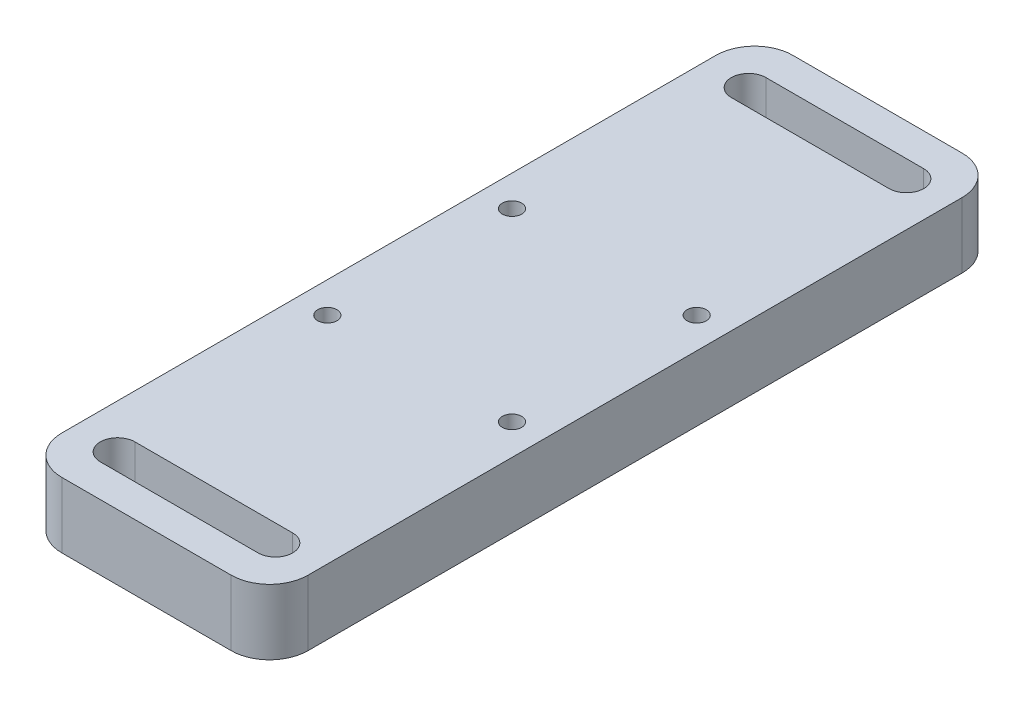
from build123d import *

# Parameters (mm, degrees)
SKETCH_1_W                = 32
SKETCH_1_H                = 35
EXTRUDE_1_DEPTH           = 10.75
SKETCH_3_W                = 3
SKETCH_3_H                = 2.25
CUT_EXTRUDE_1_DEPTH       = 49.62676732
SKETCH_6_R                = 4.5
CUT_EXTRUDE_4_DEPTH       = 2.25
EXTRUDE_2_DEPTH           = 8.5
SKETCH_10_R               = 1.25
CUT_EXTRUDE_5_DEPTH       = 74.243173743
CUT_EXTRUDE_8_DEPTH       = 4
SKETCH_13_W               = 2
SKETCH_13_H               = 2.25
EXTRUDE_3_DEPTH           = 15
SKETCH_14_R               = 3
CUT_EXTRUDE_9_DEPTH       = 73.946898495
CUT_EXTRUDE_10_DEPTH      = 68.797953509
CUT_EXTRUDE_10_DEPTH_BACK = 68.797953509
SKETCH_15_W               = 8.485281374
SKETCH_15_H               = 2.25


with BuildPart() as part:
    # Эскиз1 → Бобышка-Вытянуть1 (new body)
    with BuildSketch(Plane(origin=(0, 0, 0), x_dir=(1, 0, 0), z_dir=(0, 1, 0))):
        with Locations((16, 17.5)):
            Rectangle(SKETCH_1_W, SKETCH_1_H)
    extrude(amount=EXTRUDE_1_DEPTH)

    # Эскиз3 → Вырез-Вытянуть1 (cut, through all)
    with BuildSketch(Plane.XY):
        with Locations((16, 1.125)):
            Rectangle(SKETCH_3_W, SKETCH_3_H)
        with Locations((21, 1.125)):
            Rectangle(SKETCH_3_W, SKETCH_3_H)
        with Locations((26, 1.125)):
            Rectangle(SKETCH_3_W, SKETCH_3_H)
        with Locations((31, 1.125)):
            Rectangle(SKETCH_3_W, SKETCH_3_H)
        with Locations((11, 1.125)):
            Rectangle(SKETCH_3_W, SKETCH_3_H)
        with Locations((6, 1.125)):
            Rectangle(SKETCH_3_W, SKETCH_3_H)
        with Locations((1, 1.125)):
            Rectangle(SKETCH_3_W, SKETCH_3_H)
    extrude(amount=-CUT_EXTRUDE_1_DEPTH, mode=Mode.SUBTRACT)

    # Эскиз6 → Вырез-Вытянуть4 (cut)
    with BuildSketch(Plane.XZ):
        with Locations((16, -17.5)):
            Circle(SKETCH_6_R)
    extrude(amount=-CUT_EXTRUDE_4_DEPTH, mode=Mode.SUBTRACT)

    # Эскиз7 → Бобышка-Вытянуть2 (add)
    with BuildSketch(Plane(origin=(0, 10.75, 0), x_dir=(1, 0, 0), z_dir=(0, 1, 0))):
        with BuildLine():
            Line((0, 0), (0, -25))
            ThreePointArc((0, -25), (1.464466094, -28.535533906), (5, -30))
            Line((5, -30), (27, -30))
            ThreePointArc((27, -30), (30.535533906, -28.535533906), (32, -25))
            Line((32, -25), (32, 0))
            Line((32, 0), (0, 0))
        make_face()
        with BuildLine():
            Line((5.75, -21.25), (26.25, -21.25))
            ThreePointArc((26.25, -21.25), (28.5, -23.5), (26.25, -25.75))
            Line((26.25, -25.75), (5.75, -25.75))
            ThreePointArc((5.75, -25.75), (3.5, -23.5), (5.75, -21.25))
        make_face(mode=Mode.SUBTRACT)
    extrude_2 = extrude(amount=-EXTRUDE_2_DEPTH)

    # Зеркальное отражение1: Бобышка-Вытянуть2 across plane
    add(extrude_2.mirror(Plane.XY.offset(-17.5)))

    # Эскиз10 → Вырез-Вытянуть5 (cut, through all)
    with BuildSketch(Plane(origin=(0, 10.75, 0), x_dir=(1, 0, 0), z_dir=(0, 1, 0))):
        with Locations(Location((4, 29.5, 0), (0, 0, 270))):
            Circle(SKETCH_10_R)
        with Locations(Location((4, 5.5, 0), (0, 0, 270))):
            Circle(SKETCH_10_R)
        with Locations(Location((28, 5.5, 0), (0, 0, 270))):
            Circle(SKETCH_10_R)
        with Locations(Location((28, 29.5, 0), (0, 0, 270))):
            Circle(SKETCH_10_R)
    extrude(amount=-CUT_EXTRUDE_5_DEPTH, mode=Mode.SUBTRACT)

    # Эскиз11 → Вырез-Вытянуть8 (cut)
    with BuildSketch(Plane.XZ.offset(-2.25)):
        Polygon((25.690598923, -5.5), (26.845299462, -7.5), (29.154700538, -7.5), (30.309401077, -5.5), (29.154700538, -3.5), (26.845299462, -3.5), align=None)
        Polygon((6.309401077, -5.5), (5.154700538, -3.5), (2.845299462, -3.5), (1.690598923, -5.5), (2.845299462, -7.5), (5.154700538, -7.5), align=None)
        Polygon((6.309401077, -29.5), (5.154700538, -27.5), (2.845299462, -27.5), (1.690598923, -29.5), (2.845299462, -31.5), (5.154700538, -31.5), align=None)
        Polygon((25.690598923, -29.5), (26.845299462, -31.5), (29.154700538, -31.5), (30.309401077, -29.5), (29.154700538, -27.5), (26.845299462, -27.5), align=None)
    extrude(amount=-CUT_EXTRUDE_8_DEPTH, mode=Mode.SUBTRACT)

    # Эскиз13 → Бобышка-Вытянуть3 (add)
    with BuildSketch(Plane.XY):
        with Locations((28.5, 1.125)):
            Rectangle(SKETCH_13_W, SKETCH_13_H)
        with Locations((23.5, 1.125)):
            Rectangle(SKETCH_13_W, SKETCH_13_H)
        with Locations((18.5, 1.125)):
            Rectangle(SKETCH_13_W, SKETCH_13_H)
        with Locations((13.5, 1.125)):
            Rectangle(SKETCH_13_W, SKETCH_13_H)
        with Locations((8.5, 1.125)):
            Rectangle(SKETCH_13_W, SKETCH_13_H)
        with Locations((3.5, 1.125)):
            Rectangle(SKETCH_13_W, SKETCH_13_H)
    extrude_3 = extrude(amount=EXTRUDE_3_DEPTH)

    # Зеркальное отражение2: Бобышка-Вытянуть3 across plane
    add(extrude_3.mirror(Plane.XY.offset(-17.5)))

    # Эскиз14 → Вырез-Вытянуть9 (cut, through all)
    with BuildSketch(Plane.XZ.offset(-2.25)):
        with Locations((28, -5.5)):
            Circle(SKETCH_14_R)
        with Locations((28, -29.5)):
            Circle(SKETCH_14_R)
        with Locations((4, -29.5)):
            Circle(SKETCH_14_R)
        with Locations((4, -5.5)):
            Circle(SKETCH_14_R)
    extrude(amount=CUT_EXTRUDE_9_DEPTH, mode=Mode.SUBTRACT)

    # Эскиз15 → Вырез-Вытянуть10 (cut, two sides: drawn at the far end of the back side and taken through both)
    with BuildSketch(Plane(origin=(16, 0, 0), x_dir=(0, 0, -1), z_dir=(1, 0, 0)).offset(-CUT_EXTRUDE_10_DEPTH_BACK)):
        with Locations((17.5, 1.125)):
            Rectangle(SKETCH_15_W, SKETCH_15_H)
    extrude(amount=CUT_EXTRUDE_10_DEPTH + CUT_EXTRUDE_10_DEPTH_BACK, mode=Mode.SUBTRACT)


solid = part.part
